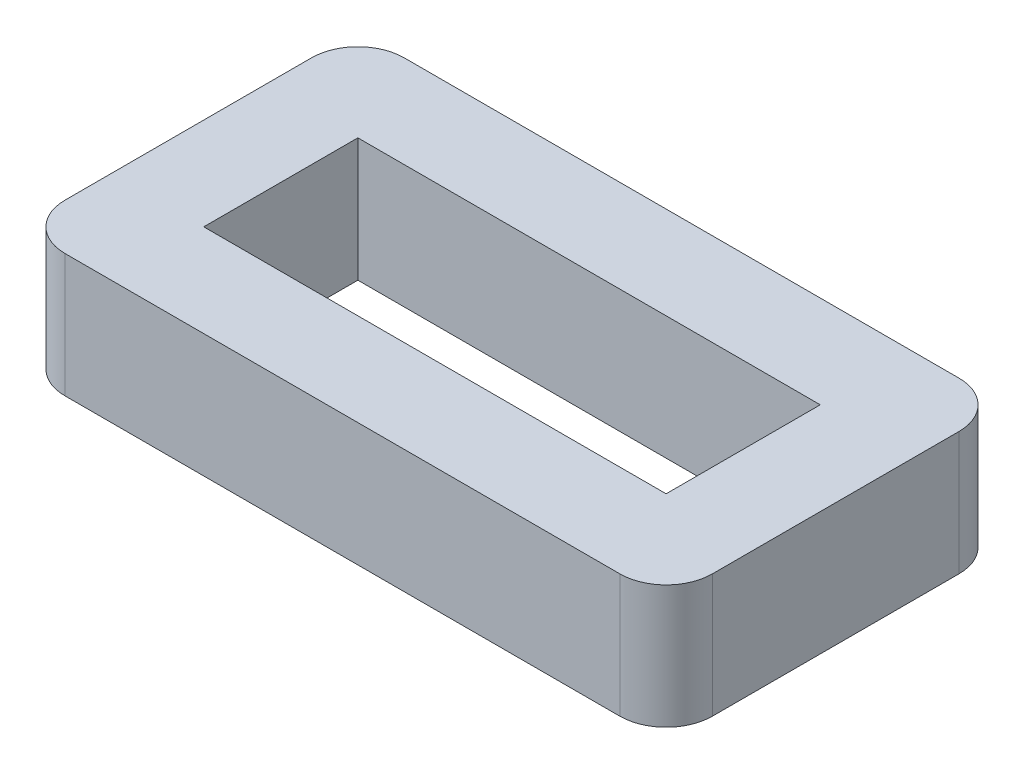
from build123d import *

# Parameters (mm, degrees)
CROQUIS1_W              = 15
CROQUIS1_H              = 5
SALIENTE_EXTRUIR1_DEPTH = 4


with BuildPart() as part:
    # Croquis1 → Saliente-Extruir1 (new body)
    with BuildSketch(Plane(origin=(0, 0, 0), x_dir=(1, 0, 0), z_dir=(0, 1, 0))):
        with BuildLine():
            Line((-10.5, 4), (-10.5, -4))
            ThreePointArc((-10.5, -4), (-10.060660172, -5.060660172), (-9, -5.5))
            Line((-9, -5.5), (9, -5.5))
            ThreePointArc((9, -5.5), (10.060660172, -5.060660172), (10.5, -4))
            Line((10.5, -4), (10.5, 4))
            ThreePointArc((10.5, 4), (10.060660172, 5.060660172), (9, 5.5))
            Line((9, 5.5), (-9, 5.5))
            ThreePointArc((-9, 5.5), (-10.060660172, 5.060660172), (-10.5, 4))
        make_face()
        Rectangle(CROQUIS1_W, CROQUIS1_H, mode=Mode.SUBTRACT)
    extrude(amount=SALIENTE_EXTRUIR1_DEPTH)


solid = part.part
